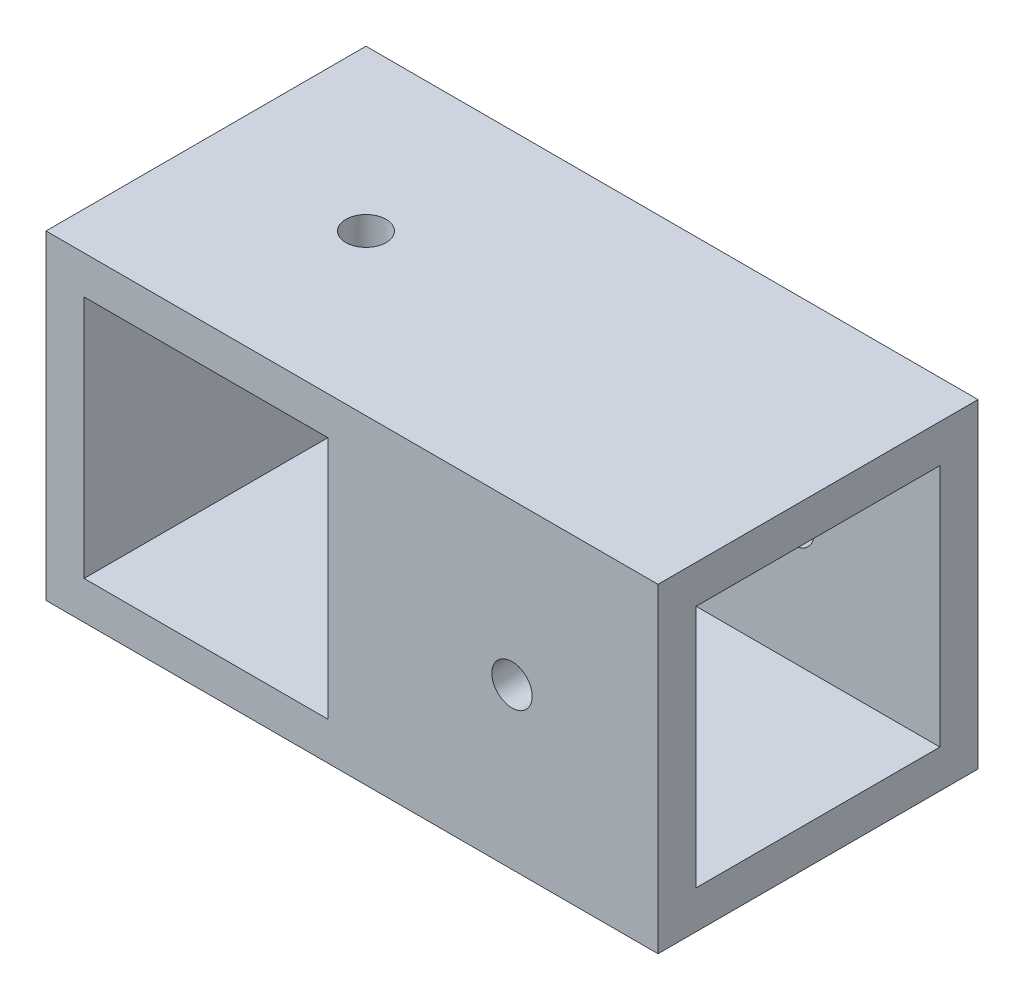
from build123d import *

# Parameters (mm, degrees)
SKETCH1_W               = 25.2
SKETCH1_H               = 25.2
SKETCH1_W_2             = 19.2
SKETCH1_H_2             = 19.2
BOSS_EXTRUDE1_DEPTH     = 25.2
SKETCH3_W               = 25.2
SKETCH3_H               = 25.2
SKETCH3_W_2             = 19.2
SKETCH3_H_2             = 19.2
BOSS_EXTRUDE2_DEPTH     = 23
CUT_EXTRUDE1_DEPTH      = 49.941189197
CUT_EXTRUDE1_DEPTH_BACK = 49.941189197
SKETCH4_R               = 1.5875
CUT_EXTRUDE2_DEPTH      = 44.805935671
CUT_EXTRUDE2_DEPTH_BACK = 44.805935671
SKETCH5_R               = 1.5875


with BuildPart() as part:
    # Sketch1 → Boss-Extrude1 (new body)
    with BuildSketch(Plane.XY):
        Rectangle(SKETCH1_W, SKETCH1_H)
        Rectangle(SKETCH1_W_2, SKETCH1_H_2, mode=Mode.SUBTRACT)
    extrude(amount=BOSS_EXTRUDE1_DEPTH)

    # Sketch3 → Boss-Extrude2 (add)
    with BuildSketch(Plane(origin=(12.6, 0, 0), x_dir=(0, 0, -1), z_dir=(1, 0, 0))):
        with Locations((-12.6, 0)):
            Rectangle(SKETCH3_W, SKETCH3_H)
        with Locations((-12.6, 0)):
            Rectangle(SKETCH3_W_2, SKETCH3_H_2, mode=Mode.SUBTRACT)
    extrude(amount=BOSS_EXTRUDE2_DEPTH)

    # Sketch4 → Cut-Extrude1 (cut, two sides: drawn at the far end of the back side and taken through both)
    with BuildSketch(Plane(origin=(0, -9.6, 0), x_dir=(1, 0, 0), z_dir=(0, 1, 0)).offset(-CUT_EXTRUDE1_DEPTH_BACK)):
        with Locations(Location((0, -12.6, 0), (0, 0, 270))):
            Circle(SKETCH4_R)
    extrude(amount=CUT_EXTRUDE1_DEPTH + CUT_EXTRUDE1_DEPTH_BACK, mode=Mode.SUBTRACT)

    # Sketch5 → Cut-Extrude2 (cut, two sides: drawn at the far end of the back side and taken through both)
    with BuildSketch(Plane.XY.offset(3).offset(-CUT_EXTRUDE2_DEPTH_BACK)):
        with Locations(Location((24.1, 0, 0), (0, 0, 270))):
            Circle(SKETCH5_R)
    extrude(amount=CUT_EXTRUDE2_DEPTH + CUT_EXTRUDE2_DEPTH_BACK, mode=Mode.SUBTRACT)


solid = part.part
